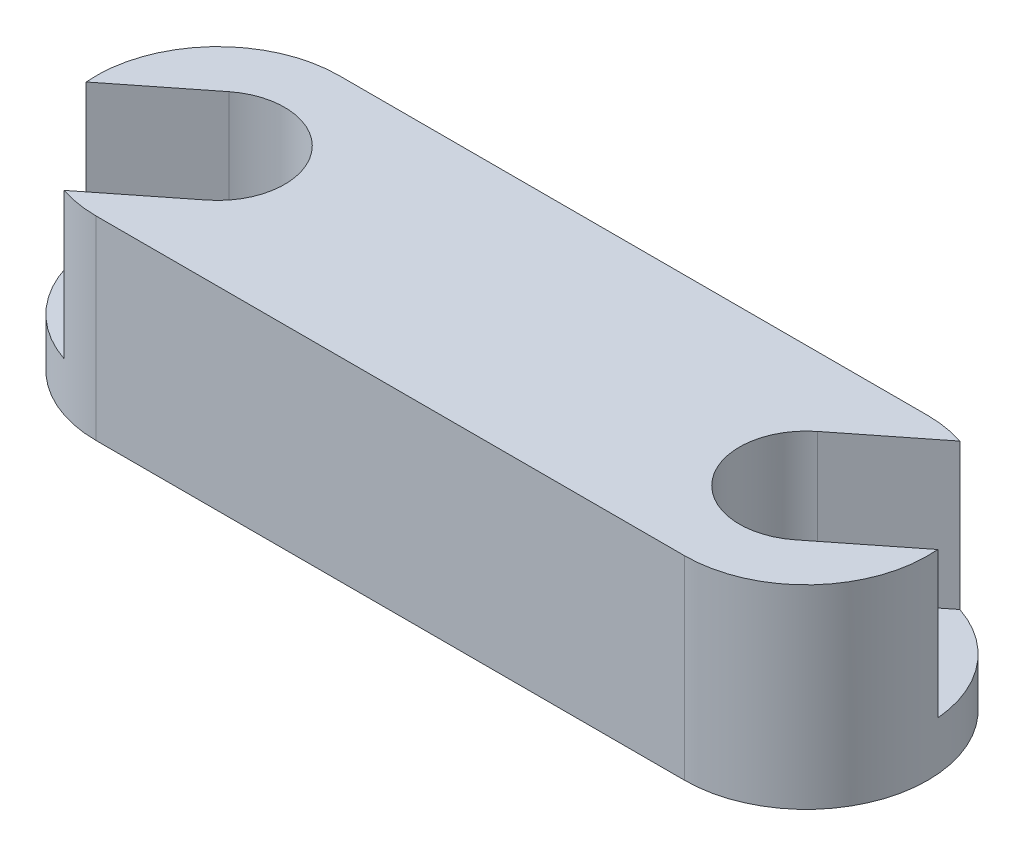
from build123d import *

# Parameters (mm, degrees)
SKETCH1_R           = 2.75
BOSS_EXTRUDE1_DEPTH = 8
CUT_EXTRUDE1_DEPTH  = 6


with BuildPart() as part:
    # Sketch1 → Boss-Extrude1 (new body)
    with BuildSketch(Plane(origin=(0, 0, 0), x_dir=(1, 0, 0), z_dir=(0, 1, 0))):
        with BuildLine():
            Line((-7.712527276, 6.5), (16.494909594, 6.5))
            ThreePointArc((16.494909594, 6.5), (21.494909594, 1.5), (16.494909594, -3.5))
            Line((16.494909594, -3.5), (-7.712527276, -3.5))
            ThreePointArc((-7.712527276, -3.5), (-12.712527276, 1.5), (-7.712527276, 6.5))
        make_face()
        with Locations(Location((-7.712527276, 1.5, 0), (0, 0, 270))):
            Circle(SKETCH1_R, mode=Mode.SUBTRACT)
        with Locations(Location((16.494909594, 1.5, 0), (0, 0, 270))):
            Circle(SKETCH1_R, mode=Mode.SUBTRACT)
    extrude(amount=BOSS_EXTRUDE1_DEPTH)

    # Sketch2 → Cut-Extrude1 (cut)
    with BuildSketch(Plane(origin=(0, 8, 0), x_dir=(1, 0, 0), z_dir=(0, 1, 0))):
        Polygon((14.7908878, 3.658427605), (18.198931387, -0.658427605), (28.129781504, 7.181717223), (24.721737917, 11.498572433), align=None)
        Polygon((-6.008505483, -0.658427605), (-9.41654907, 3.658427605), (-19.347399186, -4.181717223), (-15.939355599, -8.498572433), align=None)
    extrude(amount=-CUT_EXTRUDE1_DEPTH, mode=Mode.SUBTRACT)


solid = part.part
